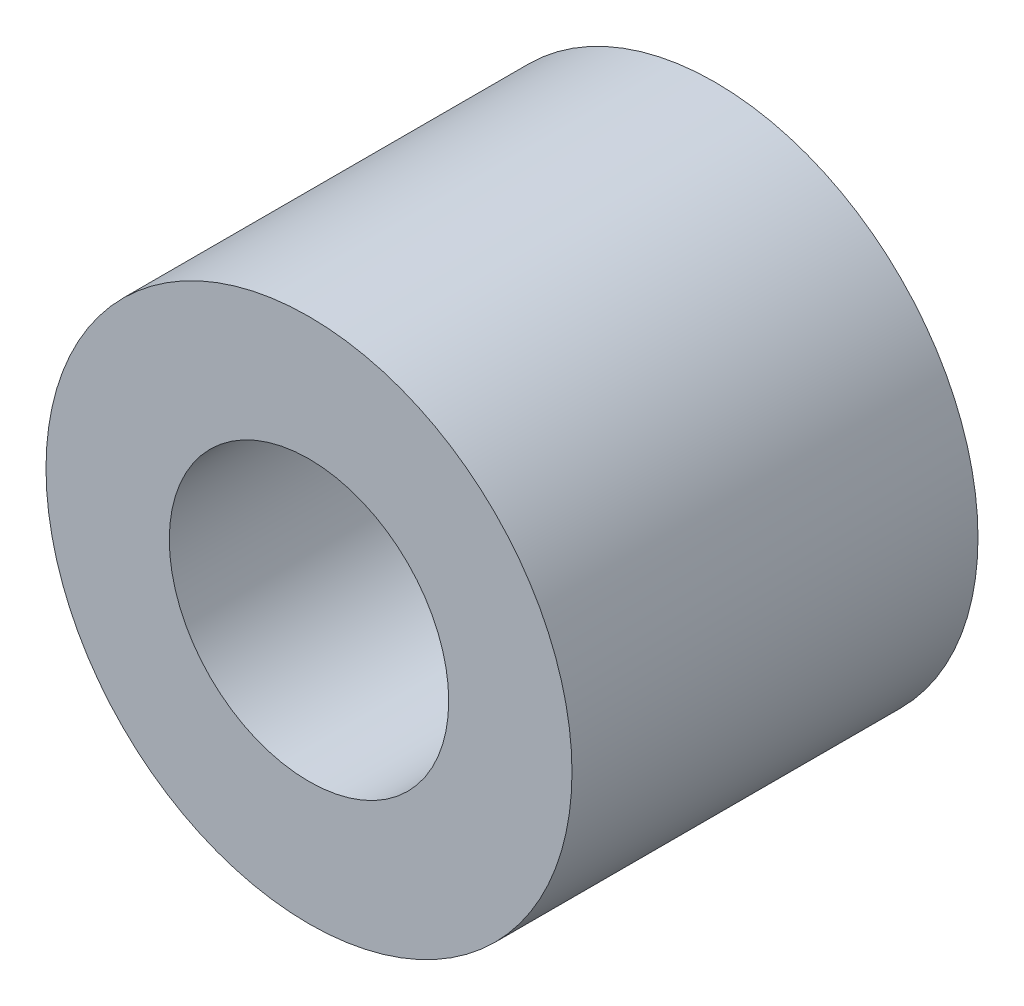
from build123d import *

# Parameters (mm, degrees)
SKETCH_1_R      = 8
SKETCH_1_R_2    = 4.25
EXTRUDE_1_DEPTH = 12.35


with BuildPart() as part:
    # 草图1 → 凸台-拉伸1 (new body)
    with BuildSketch(Plane.XY):
        Circle(SKETCH_1_R)
        Circle(SKETCH_1_R_2, mode=Mode.SUBTRACT)
    extrude(amount=EXTRUDE_1_DEPTH)


solid = part.part
